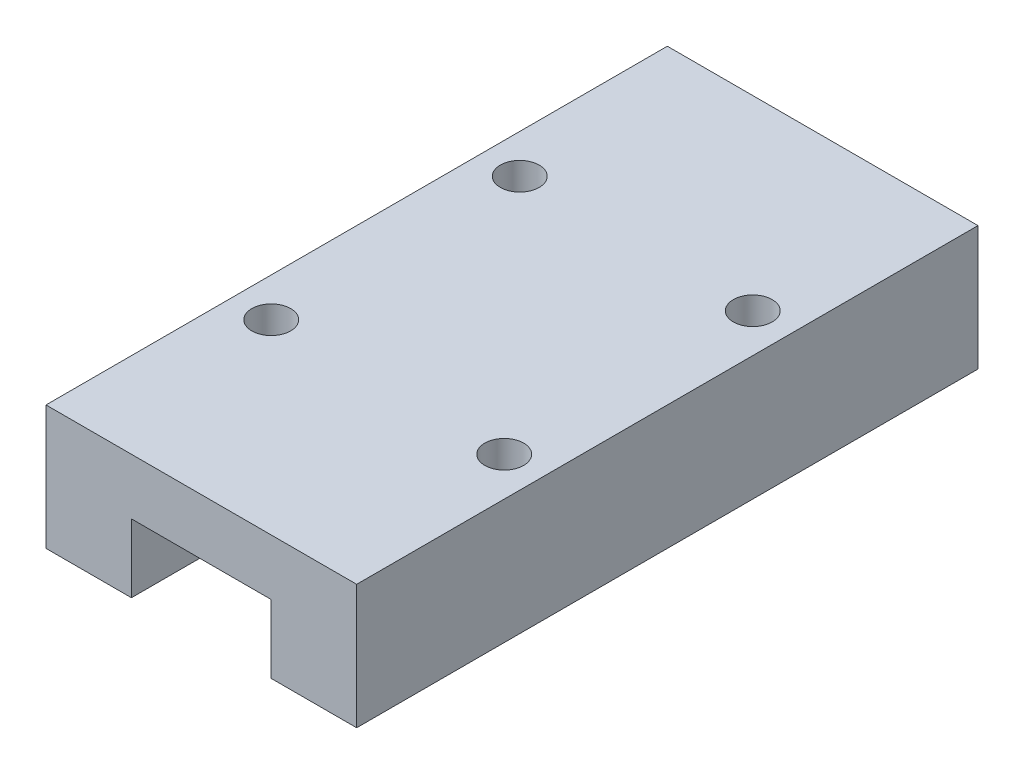
from build123d import *

# Parameters (mm, degrees)
BOSS_EXTRUDE1_DEPTH = 40
SKETCH2_R           = 1.25
CUT_EXTRUDE1_DEPTH  = 5


with BuildPart() as part:
    # Sketch1 → Boss-Extrude1 (new body)
    with BuildSketch(Plane.XY):
        Polygon((0, 0), (5.5, 0), (5.5, 4.4), (14.5, 4.4), (14.5, 0), (20, 0), (20, 8), (0, 8), align=None)
    extrude(amount=BOSS_EXTRUDE1_DEPTH)

    # Sketch2 → Cut-Extrude1 (cut)
    with BuildSketch(Plane(origin=(0, 8, 0), x_dir=(1, 0, 0), z_dir=(0, 1, 0))):
        with Locations(Location((2.5, -12, 0), (0, 0, 270))):
            Circle(SKETCH2_R)
        with Locations(Location((17.5, -12, 0), (0, 0, 90))):
            Circle(SKETCH2_R)
        with Locations(Location((17.5, -28, 0), (0, 0, 270))):
            Circle(SKETCH2_R)
        with Locations(Location((2.5, -28, 0), (0, 0, 90))):
            Circle(SKETCH2_R)
    extrude(amount=-CUT_EXTRUDE1_DEPTH, mode=Mode.SUBTRACT)


solid = part.part
